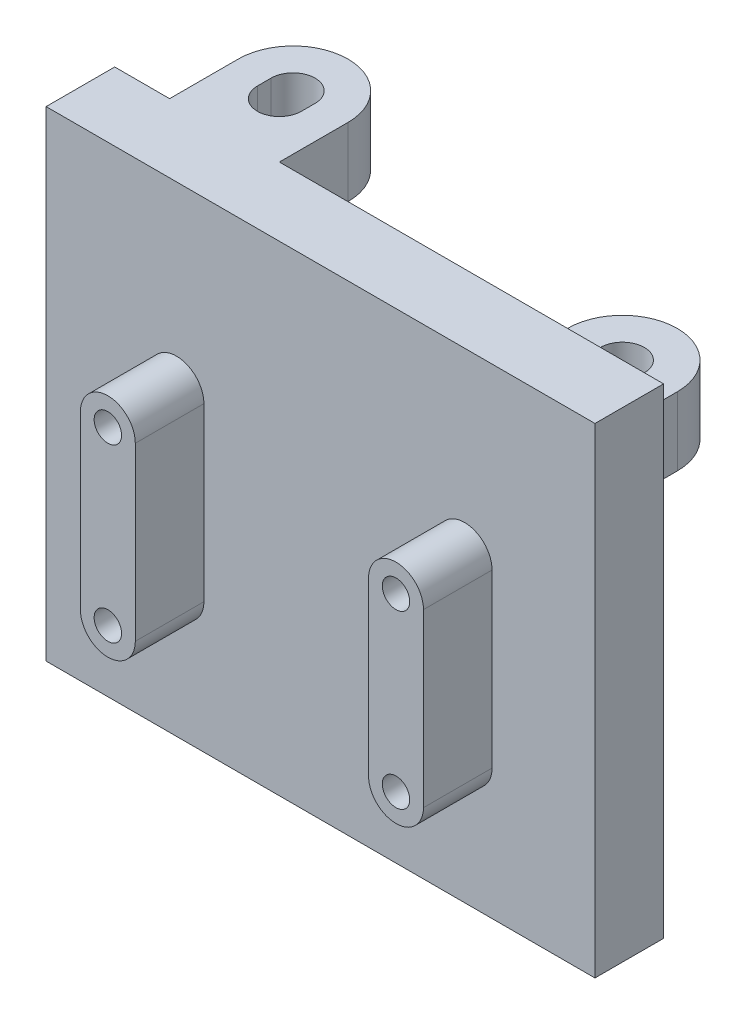
from build123d import *

# Parameters (mm, degrees)
BOSS_EXTRUDE1_DEPTH = 5
BOSS_EXTRUDE2_DEPTH = 5
BOSS_EXTRUDE3_DEPTH = 30
SKETCH2_W           = 10
SKETCH2_H           = 35
SKETCH2_R           = 1
CUT_EXTRUDE1_DEPTH  = 45.676615807
BOSS_EXTRUDE4_START = 5
SKETCH2_3_R         = 1
BOSS_EXTRUDE4_DEPTH = 5


with BuildPart() as part:
    # Sketch1 → Boss-Extrude1 (new body)
    with BuildSketch(Plane(origin=(0, 0, 0), x_dir=(1, 0, 0), z_dir=(0, 1, 0))):
        with BuildLine():
            Line((-16, 0), (-30, 0))
            Line((-30, 0), (-30, -5))
            Line((-30, -5), (30, -5))
            Line((30, -5), (30, 0))
            Line((30, 0), (-8, 0))
            Line((-8, 0), (-8, 5))
            ThreePointArc((-8, 5), (-12, 9), (-16, 5))
            Line((-16, 5), (-16, 0))
        make_face()
        with BuildLine():
            ThreePointArc((-13.6, 5), (-12, 6.6), (-10.4, 5))
            Line((-10.4, 5), (-10.4, 4))
            ThreePointArc((-10.4, 4), (-12, 2.4), (-13.6, 4))
            Line((-13.6, 4), (-13.6, 5))
        make_face(mode=Mode.SUBTRACT)
    extrude(amount=BOSS_EXTRUDE1_DEPTH)

    # Sketch1<3> → Boss-Extrude2 (add)
    with BuildSketch(Plane(origin=(0, 0, 0), x_dir=(1, 0, 0), z_dir=(0, 1, 0))):
        with BuildLine():
            Line((-30, 0), (-30, -5))
            Line((-30, -5), (30, -5))
            Line((30, -5), (30, 0))
            Line((30, 0), (16, 0))
            Line((16, 0), (16, 5))
            ThreePointArc((16, 5), (12, 9), (8, 5))
            Line((8, 5), (8, 0))
            Line((8, 0), (-30, 0))
        make_face()
        with BuildLine():
            Line((13.6, 5), (13.6, 4))
            ThreePointArc((13.6, 4), (12, 2.4), (10.4, 4))
            Line((10.4, 4), (10.4, 5))
            ThreePointArc((10.4, 5), (12, 6.6), (13.6, 5))
        make_face(mode=Mode.SUBTRACT)
    extrude(amount=-BOSS_EXTRUDE2_DEPTH)

    # Sketch1<4> → Boss-Extrude3 (add)
    with BuildSketch(Plane(origin=(0, 0, 0), x_dir=(1, 0, 0), z_dir=(0, 1, 0))):
        Polygon((-16, 0), (-30, 0), (-30, -5), (30, -5), (30, 0), (16, 0), (8, 0), (-8, 0), align=None)
    extrude(amount=-BOSS_EXTRUDE3_DEPTH)

    # Sketch2 → Cut-Extrude1 (cut, through all)
    with BuildSketch(Plane.XY.offset(5)):
        with Locations((-25, -12.5)):
            Rectangle(SKETCH2_W, SKETCH2_H)
        with Locations((25, -12.5)):
            Rectangle(SKETCH2_W, SKETCH2_H)
        with Locations((-10.5, -8)):
            Circle(SKETCH2_R)
        with Locations((-10.5, -20.5)):
            Circle(SKETCH2_R)
        with Locations((10.5, -20.5)):
            Circle(SKETCH2_R)
        with Locations((10.5, -8)):
            Circle(SKETCH2_R)
    extrude(amount=-CUT_EXTRUDE1_DEPTH, mode=Mode.SUBTRACT)

    # Sketch2<3> → Boss-Extrude4 (add)
    # profile 1 of 2: a face of its own
    with BuildSketch(Plane.XY.offset(5).offset(BOSS_EXTRUDE4_START)):
        with BuildLine():
            Line((-8.5, -20.5), (-8.5, -8))
            ThreePointArc((-8.5, -8), (-10.5, -6), (-12.5, -8))
            Line((-12.5, -8), (-12.5, -20.5))
            ThreePointArc((-12.5, -20.5), (-10.5, -22.5), (-8.5, -20.5))
        make_face()
        with Locations((-10.5, -20.5)):
            Circle(SKETCH2_3_R, mode=Mode.SUBTRACT)
        with Locations((-10.5, -8)):
            Circle(SKETCH2_3_R, mode=Mode.SUBTRACT)
    # profile 2 of 2: a face of its own
    with BuildSketch(Plane.XY.offset(5).offset(BOSS_EXTRUDE4_START)):
        with BuildLine():
            ThreePointArc((12.5, -8), (10.5, -6), (8.5, -8))
            Line((8.5, -8), (8.5, -20.5))
            ThreePointArc((8.5, -20.5), (10.5, -22.5), (12.5, -20.5))
            Line((12.5, -20.5), (12.5, -8))
        make_face()
        with Locations((10.5, -20.5)):
            Circle(SKETCH2_3_R, mode=Mode.SUBTRACT)
        with Locations((10.5, -8)):
            Circle(SKETCH2_3_R, mode=Mode.SUBTRACT)
    extrude(amount=-BOSS_EXTRUDE4_DEPTH)


solid = part.part
